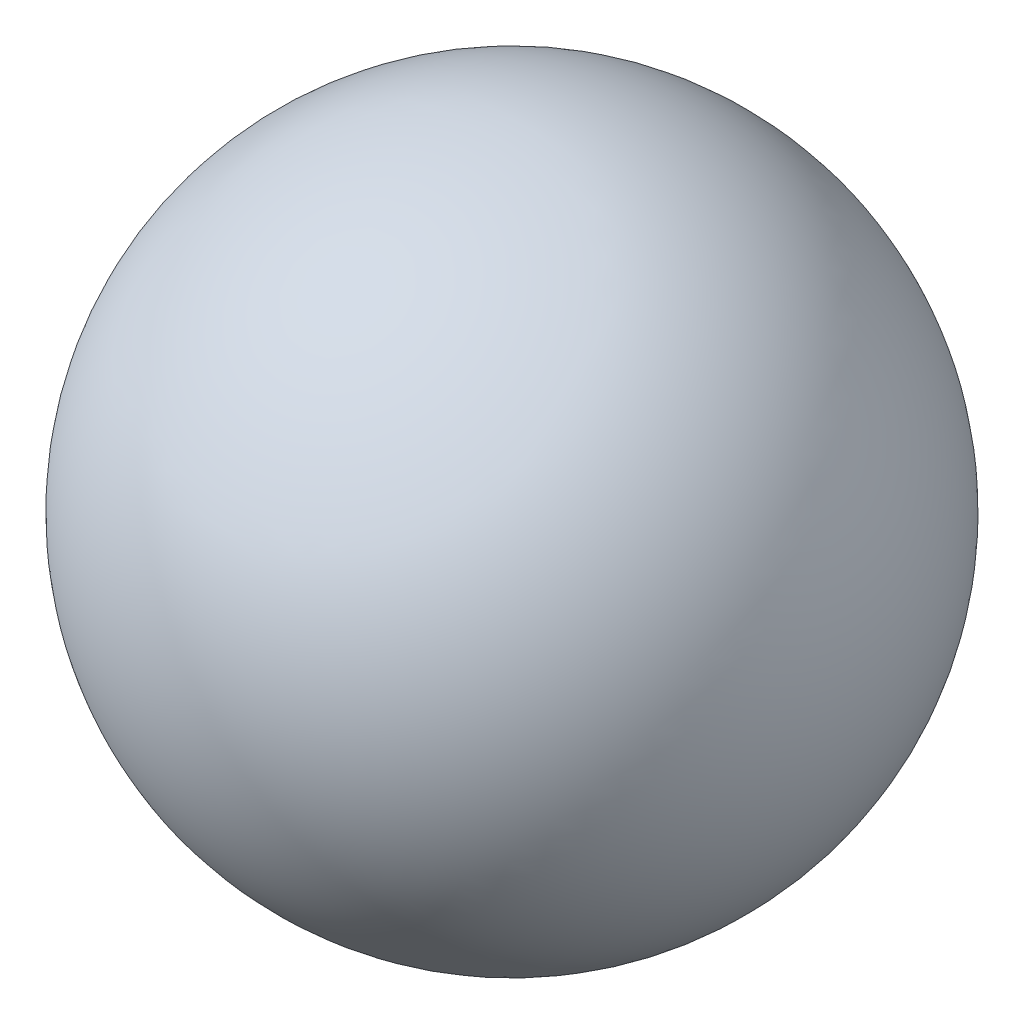
from build123d import *


with BuildPart() as part:
    # Sketch1 → Revolve1 (revolve)
    with BuildSketch(Plane(origin=(0, 0, 0), x_dir=(1, 0, 0), z_dir=(0, 1, 0))):
        with BuildLine():
            Line((0, 17.5), (0, -17.5))
            ThreePointArc((0, -17.5), (17.5, 0), (0, 17.5))
        make_face()
    revolve(axis=Axis((0, 0, -22.65713246), (0, 0, 1)))


solid = part.part
